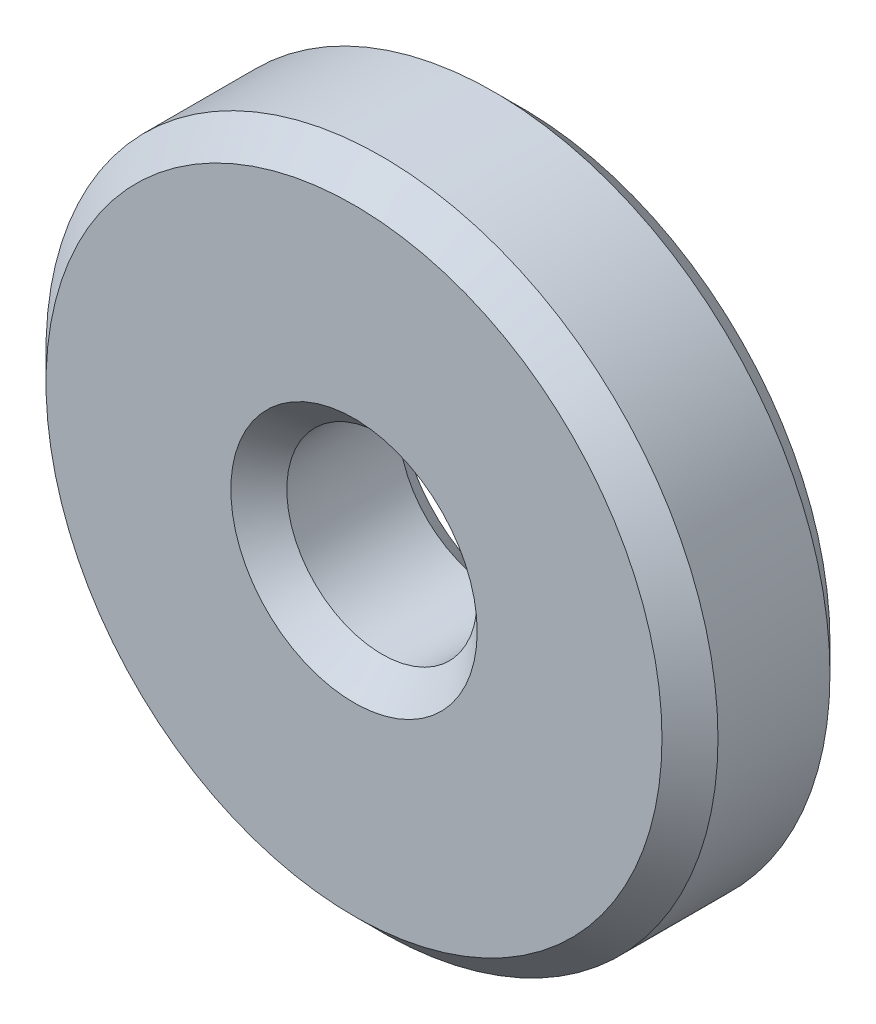
from build123d import *

# Parameters (mm, degrees)
SKETCH1_R           = 6
SKETCH1_R_2         = 1.7
BOSS_EXTRUDE1_DEPTH = 3
CHAMFER1_SIZE       = 0.5


with BuildPart() as part:
    # Sketch1 → Boss-Extrude1 (new body)
    with BuildSketch(Plane.XY):
        Circle(SKETCH1_R)
        Circle(SKETCH1_R_2, mode=Mode.SUBTRACT)
    extrude(amount=BOSS_EXTRUDE1_DEPTH)

    # Chamfer1
    chamfer1_edges = [part.edges().sort_by_distance(p)[0] for p in [
        (-6, 0, 0),
        (-6, 0, 3),
        (-1.7, 0, 0),
        (-1.7, 0, 3),
    ]]
    chamfer(chamfer1_edges, length=CHAMFER1_SIZE)


solid = part.part
